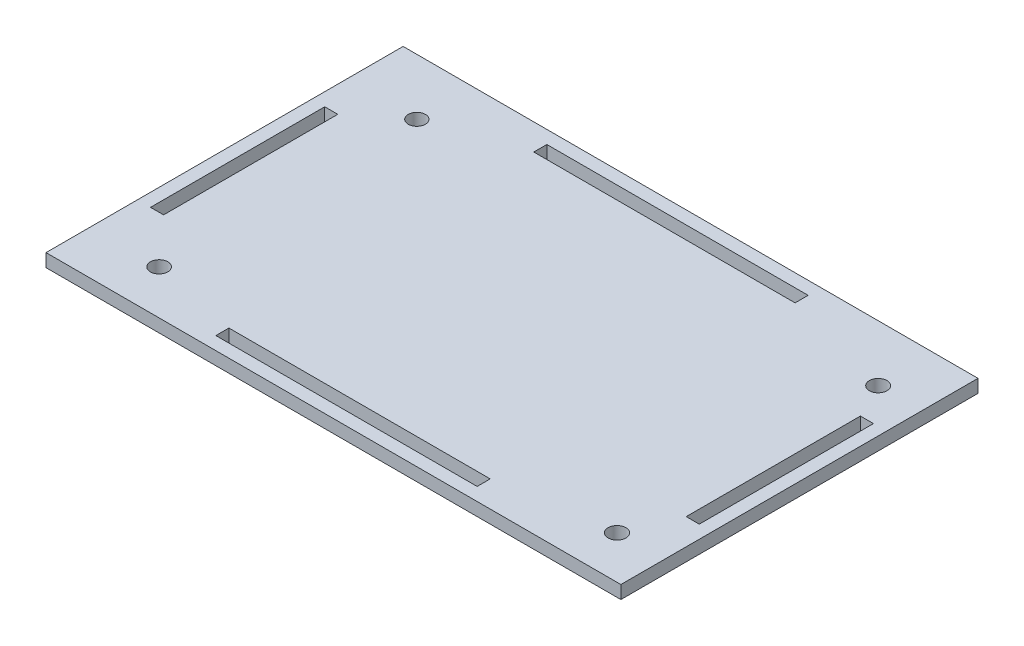
from build123d import *

# Parameters (mm, degrees)
SKETCH2_W           = 132
SKETCH2_H           = 82
SKETCH2_R           = 2.006523595
SKETCH2_R_2         = 1.973801087
SKETCH2_R_3         = 2.048724415
SKETCH2_R_4         = 2.024407748
SKETCH2_W_2         = 3
SKETCH2_H_2         = 40
SKETCH2_W_3         = 60
SKETCH2_H_3         = 3
BOSS_EXTRUDE1_DEPTH = 3


with BuildPart() as part:
    # Sketch2 → Boss-Extrude1 (new body)
    with BuildSketch(Plane(origin=(0, 0, 0), x_dir=(1, 0, 0), z_dir=(0, 1, 0))):
        with Locations((-60, 35)):
            Rectangle(SKETCH2_W, SKETCH2_H)
        with Locations(Location((-110.18079739, 4.154783893, 0), (0, 0, 270))):
            Circle(SKETCH2_R, mode=Mode.SUBTRACT)
        with Locations(Location((-109.92679739, 63.080540095, 0), (0, 0, 270))):
            Circle(SKETCH2_R_2, mode=Mode.SUBTRACT)
        with Locations(Location((-4.720233043, 3.837756232, 0), (0, 0, 270))):
            Circle(SKETCH2_R_3, mode=Mode.SUBTRACT)
        with Locations(Location((-4.004277447, 63.080540095, 0), (0, 0, 270))):
            Circle(SKETCH2_R_4, mode=Mode.SUBTRACT)
        with Locations((1.5, 35)):
            Rectangle(SKETCH2_W_2, SKETCH2_H_2, mode=Mode.SUBTRACT)
        with Locations((-121.5, 35)):
            Rectangle(SKETCH2_W_2, SKETCH2_H_2, mode=Mode.SUBTRACT)
        with Locations((-60, 71.5)):
            Rectangle(SKETCH2_W_3, SKETCH2_H_3, mode=Mode.SUBTRACT)
        with Locations((-60, -1.5)):
            Rectangle(SKETCH2_W_3, SKETCH2_H_3, mode=Mode.SUBTRACT)
    extrude(amount=BOSS_EXTRUDE1_DEPTH)


solid = part.part
